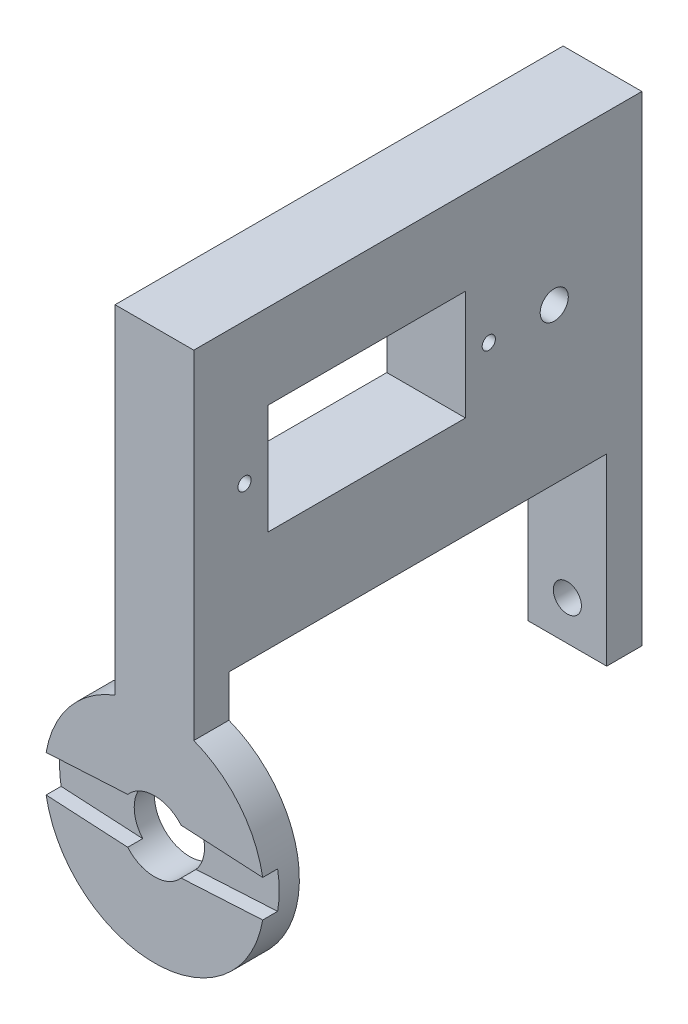
from build123d import *

# Parameters (mm, degrees)
SKETCH1_R           = 12.5
SKETCH1_R_2         = 4
BOSS_EXTRUDE1_DEPTH = 4
CUT_EXTRUDE1_DEPTH  = 1.7
SKETCH3_W           = 8.958376624
SKETCH3_H           = 30
BOSS_EXTRUDE2_DEPTH = 4
SKETCH4_W           = 8.958376624
SKETCH4_H           = 24.069748571
BOSS_EXTRUDE3_DEPTH = 47
SKETCH5_W           = 8.958376624
SKETCH5_H           = 45
SKETCH5_R           = 1.6
BOSS_EXTRUDE4_DEPTH = 4
SKETCH6_W           = 22.5
SKETCH6_H           = 12.5
CUT_EXTRUDE2_DEPTH  = 68.301878397
SKETCH7_R           = 1.6
CUT_EXTRUDE3_DEPTH  = 68.301878397
SKETCH8_R           = 0.75
CUT_EXTRUDE4_DEPTH  = 68.301878397
SKETCH9_W           = 51
SKETCH9_H           = 9.652107549
BOSS_EXTRUDE5_DEPTH = 8.95837662


with BuildPart() as part:
    # Sketch1 → Boss-Extrude1 (new body)
    with BuildSketch(Plane.XY):
        Circle(SKETCH1_R)
        Circle(SKETCH1_R_2, mode=Mode.SUBTRACT)
    extrude(amount=-BOSS_EXTRUDE1_DEPTH)

    # Sketch2 → Cut-Extrude1 (cut)
    with BuildSketch(Plane.XY):
        with BuildLine():
            Line((14.05, 2), (3.035592941, 2.604836943))
            ThreePointArc((3.035592941, 2.604836943), (0, 4), (-3.035592941, 2.604836943))
            Line((-3.035592941, 2.604836943), (-14.05, 2))
            ThreePointArc((-14.05, 2), (-16.05, 0), (-14.05, -2))
            Line((-14.05, -2), (-3.035592941, -2.604836943))
            ThreePointArc((-3.035592941, -2.604836943), (0, -4), (3.035592941, -2.604836943))
            Line((3.035592941, -2.604836943), (14.05, -2))
            ThreePointArc((14.05, -2), (16.05, 0), (14.05, 2))
        make_face()
    extrude(amount=-CUT_EXTRUDE1_DEPTH, mode=Mode.SUBTRACT)

    # Sketch3 → Boss-Extrude2 (add)
    with BuildSketch(Plane.XY):
        with Locations((0, 25.5)):
            Rectangle(SKETCH3_W, SKETCH3_H)
    extrude(amount=-BOSS_EXTRUDE2_DEPTH)

    # Sketch4 → Boss-Extrude3 (add)
    with BuildSketch(Plane(origin=(0, 0, -4), x_dir=(-1, 0, 0), z_dir=(0, 0, -1))):
        with Locations((0, 28.465125715)):
            Rectangle(SKETCH4_W, SKETCH4_H)
    extrude(amount=BOSS_EXTRUDE3_DEPTH)

    # Sketch5 → Boss-Extrude4 (add)
    with BuildSketch(Plane(origin=(0, 0, -51), x_dir=(-1, 0, 0), z_dir=(0, 0, -1))):
        with Locations((0, 18)):
            Rectangle(SKETCH5_W, SKETCH5_H)
        Circle(SKETCH5_R, mode=Mode.SUBTRACT)
    extrude(amount=-BOSS_EXTRUDE4_DEPTH)

    # Sketch6 → Cut-Extrude2 (cut, through all)
    with BuildSketch(Plane(origin=(4.479188312, 0, 0), x_dir=(0, 0, -1), z_dir=(1, 0, 0))):
        with Locations((19.677937554, 34.25)):
            Rectangle(SKETCH6_W, SKETCH6_H)
    extrude(amount=-CUT_EXTRUDE2_DEPTH, mode=Mode.SUBTRACT)

    # Sketch7 → Cut-Extrude3 (cut, through all)
    with BuildSketch(Plane(origin=(4.479188312, 0, 0), x_dir=(0, 0, -1), z_dir=(1, 0, 0))):
        with Locations((41.027937554, 34.1)):
            Circle(SKETCH7_R)
    extrude(amount=-CUT_EXTRUDE3_DEPTH, mode=Mode.SUBTRACT)

    # Sketch8 → Cut-Extrude4 (cut, through all)
    with BuildSketch(Plane.ZY.offset(4.479188312)):
        with Locations((-33.577937554, 34.1)):
            Circle(SKETCH8_R)
        with Locations((-5.777937554, 34.1)):
            Circle(SKETCH8_R)
    extrude(amount=-CUT_EXTRUDE4_DEPTH, mode=Mode.SUBTRACT)

    # Sketch9 → Boss-Extrude5 (add)
    with BuildSketch(Plane(origin=(4.479188312, 0, 0), x_dir=(0, 0, -1), z_dir=(1, 0, 0))):
        with Locations((25.5, 45.326053774)):
            Rectangle(SKETCH9_W, SKETCH9_H)
    extrude(amount=-BOSS_EXTRUDE5_DEPTH)


solid = part.part
